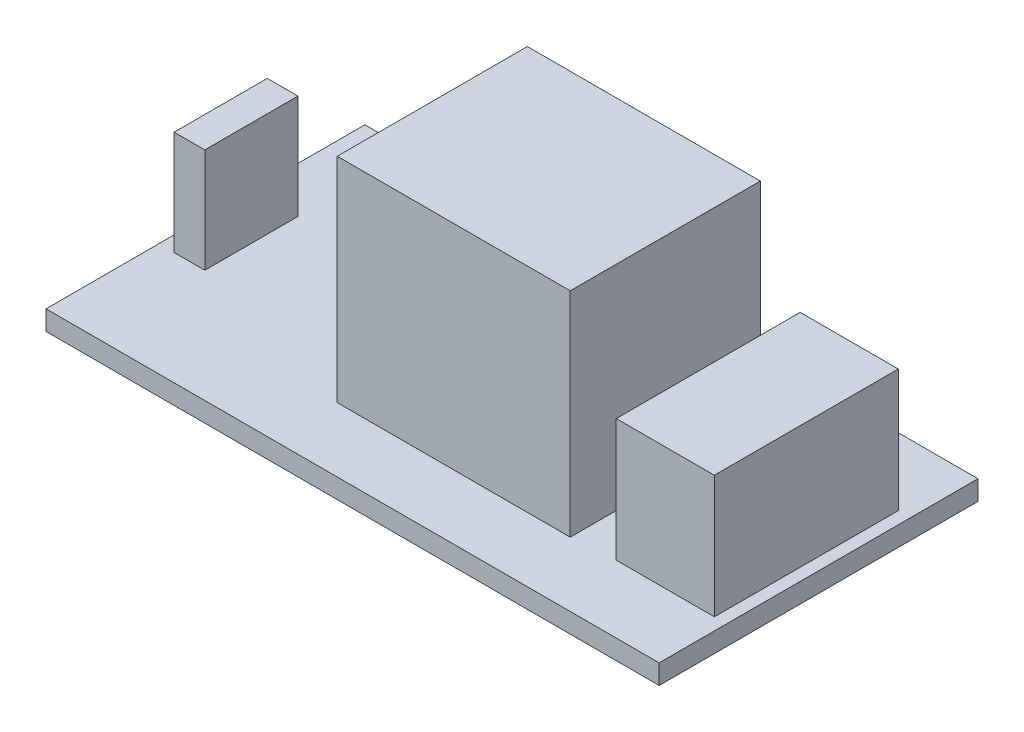
from build123d import *

# Parameters (mm, degrees)
SKETCH1_W            = 50
SKETCH1_H            = 26
BOARD_DEPTH          = 1.6
RELAY_START          = 1.6
SKETCH2_W            = 19
SKETCH2_H            = 15.5
RELAY_DEPTH          = 17.4
TERMINAL_BLOCK_START = 1.6
SKETCH3_W            = 8
SKETCH3_H            = 15
TERMINAL_BLOCK_DEPTH = 10
HEADER_START         = 1.6
SKETCH4_W            = 2.5
SKETCH4_H            = 7.6
HEADER_DEPTH         = 8.5


with BuildPart() as part:
    # Sketch1 → Board (new body)
    with BuildSketch(Plane(origin=(0, 0, 0), x_dir=(1, 0, 0), z_dir=(0, 1, 0))):
        Rectangle(SKETCH1_W, SKETCH1_H)
    extrude(amount=BOARD_DEPTH)

    # Sketch2 → Relay (add)
    with BuildSketch(Plane(origin=(0, 0, 0), x_dir=(1, 0, 0), z_dir=(0, 1, 0)).offset(RELAY_START)):
        with Locations((3, 0)):
            Rectangle(SKETCH2_W, SKETCH2_H)
    extrude(amount=RELAY_DEPTH)

    # Sketch3 → Terminal_Block (add)
    with BuildSketch(Plane(origin=(0, 0, 0), x_dir=(1, 0, 0), z_dir=(0, 1, 0)).offset(TERMINAL_BLOCK_START)):
        with Locations((20, 0)):
            Rectangle(SKETCH3_W, SKETCH3_H)
    extrude(amount=TERMINAL_BLOCK_DEPTH)

    # Sketch4 → Header (add)
    with BuildSketch(Plane(origin=(0, 0, 0), x_dir=(1, 0, 0), z_dir=(0, 1, 0)).offset(HEADER_START)):
        with Locations((-22.5, 0)):
            Rectangle(SKETCH4_W, SKETCH4_H)
    extrude(amount=HEADER_DEPTH)


solid = part.part
